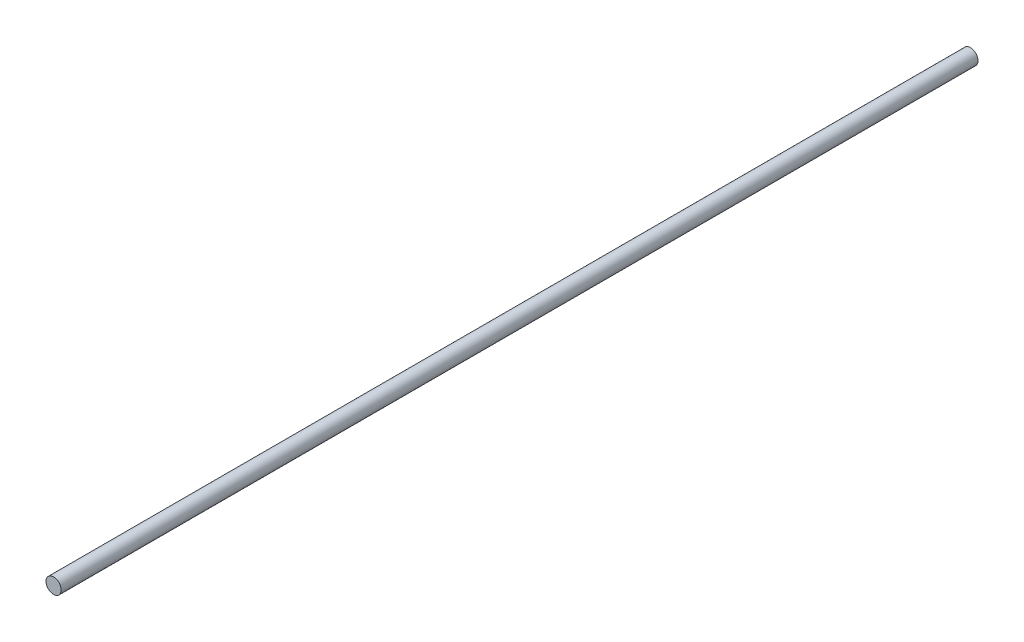
from build123d import *

# Parameters (mm, degrees)
SKETCH1_R           = 1.7
BOSS_EXTRUDE1_DEPTH = 102.5


with BuildPart() as part:
    # Sketch1 → Boss-Extrude1 (new, symmetric)
    with BuildSketch(Plane.XY):
        with Locations(Location((0, 0, 0), (0, 0, 180))):
            Circle(SKETCH1_R)
    extrude(amount=BOSS_EXTRUDE1_DEPTH, both=True)


solid = part.part
